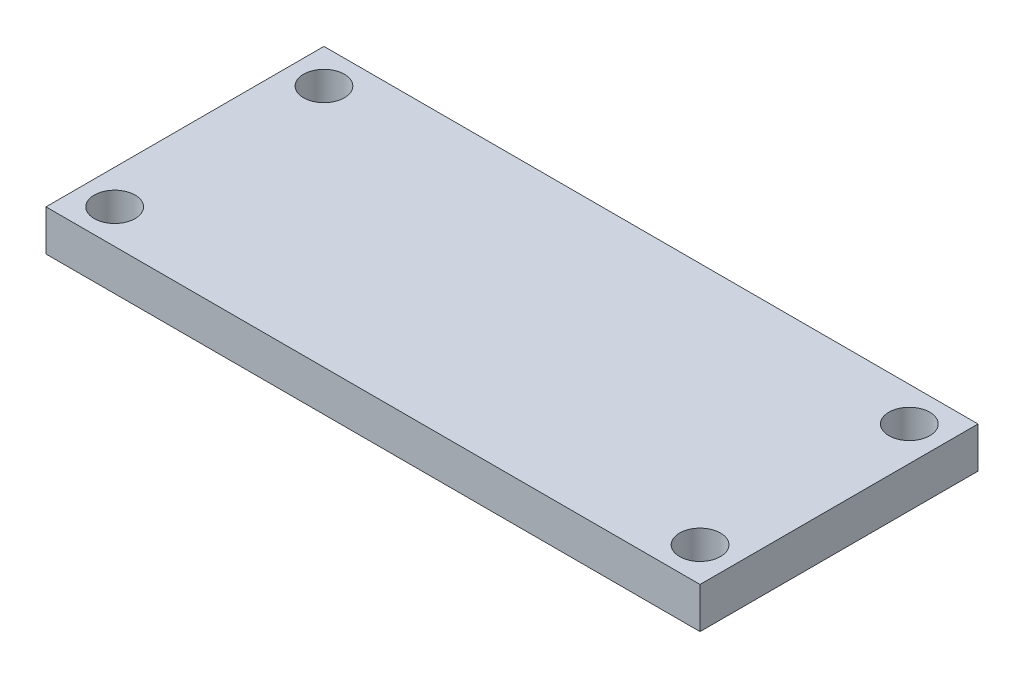
from build123d import *

# Parameters (mm, degrees)
SKETCH1_W           = 4.2
SKETCH1_H           = 8.6
SKETCH1_H_2         = 4.2
SKETCH1_R           = 1.25
BOSS_EXTRUDE1_DEPTH = 2.5


with BuildPart() as part:
    # Sketch1 → Boss-Extrude1 (new body)
    # profile 1 of 7: a face of its own
    with BuildSketch(Plane(origin=(0, 0, 0), x_dir=(1, 0, 0), z_dir=(0, 1, 0))):
        Polygon((-15.8, 8.5), (-15.8, 4.3), (-15.8, -4.3), (-15.8, -8.5), (15.8, -8.5), (15.8, -4.3), (15.8, 4.3), (15.8, 8.5), align=None)
    # profile 2 of 7: a face of its own
    with BuildSketch(Plane(origin=(0, 0, 0), x_dir=(1, 0, 0), z_dir=(0, 1, 0))):
        with Locations((-17.9, 0)):
            Rectangle(SKETCH1_W, SKETCH1_H)
    # profile 3 of 7: a face of its own
    with BuildSketch(Plane(origin=(0, 0, 0), x_dir=(1, 0, 0), z_dir=(0, 1, 0))):
        with Locations((-17.9, -6.4)):
            Rectangle(SKETCH1_W, SKETCH1_H_2)
        with Locations(Location((-17.9, -6.4, 0), (0, 0, 270))):
            Circle(SKETCH1_R, mode=Mode.SUBTRACT)
    # profile 4 of 7: a face of its own
    with BuildSketch(Plane(origin=(0, 0, 0), x_dir=(1, 0, 0), z_dir=(0, 1, 0))):
        with Locations((17.9, 6.4)):
            Rectangle(SKETCH1_W, SKETCH1_H_2)
        with Locations(Location((17.9, 6.4, 0), (0, 0, 270))):
            Circle(SKETCH1_R, mode=Mode.SUBTRACT)
    # profile 5 of 7: a face of its own
    with BuildSketch(Plane(origin=(0, 0, 0), x_dir=(1, 0, 0), z_dir=(0, 1, 0))):
        with Locations((17.9, 0)):
            Rectangle(SKETCH1_W, SKETCH1_H)
    # profile 6 of 7: a face of its own
    with BuildSketch(Plane(origin=(0, 0, 0), x_dir=(1, 0, 0), z_dir=(0, 1, 0))):
        with Locations((17.9, -6.4)):
            Rectangle(SKETCH1_W, SKETCH1_H_2)
        with Locations(Location((17.9, -6.4, 0), (0, 0, 270))):
            Circle(SKETCH1_R, mode=Mode.SUBTRACT)
    # profile 7 of 7: a face of its own
    with BuildSketch(Plane(origin=(0, 0, 0), x_dir=(1, 0, 0), z_dir=(0, 1, 0))):
        with Locations((-17.9, 6.4)):
            Rectangle(SKETCH1_W, SKETCH1_H_2)
        with Locations(Location((-17.9, 6.4, 0), (0, 0, 270))):
            Circle(SKETCH1_R, mode=Mode.SUBTRACT)
    extrude(amount=BOSS_EXTRUDE1_DEPTH)


solid = part.part
